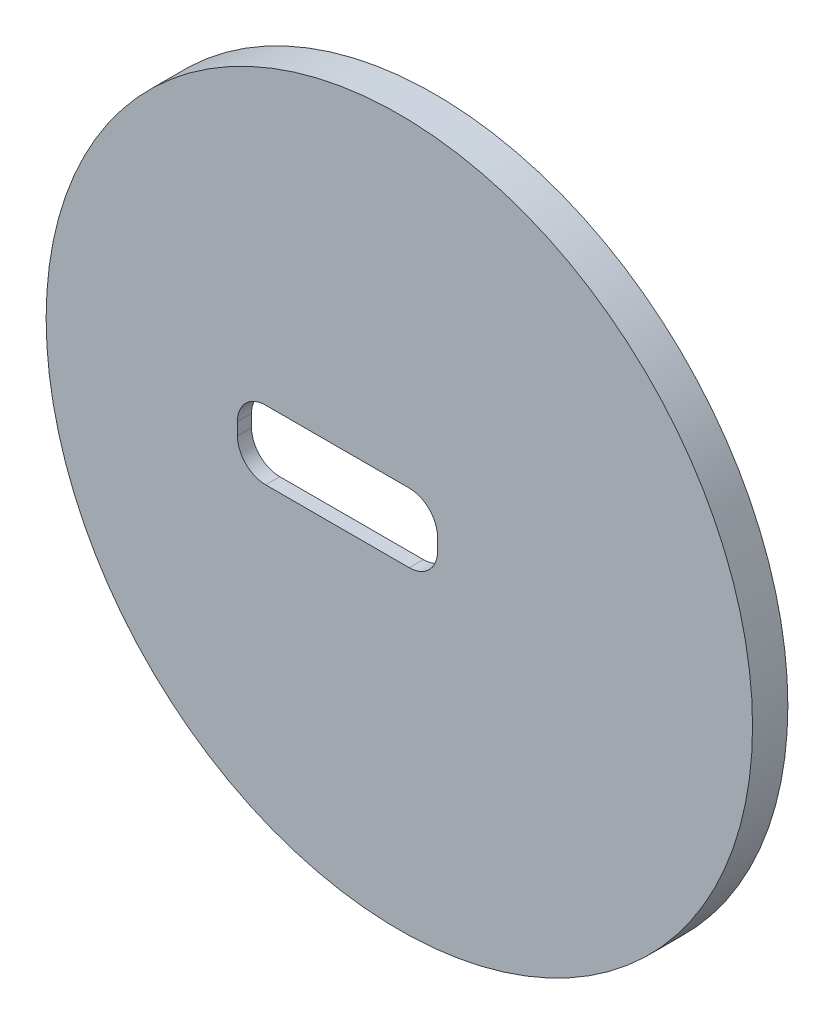
from build123d import *

# Parameters (mm, degrees)
SKETCH3_R           = 63.5
BOSS_EXTRUDE1_DEPTH = 6.35
SKETCH2_W           = 46.99
SKETCH2_H           = 26.67
CUT_EXTRUDE1_DEPTH  = 3.81
FILLET1_R           = 6.35
SKETCH6_W           = 35.970839212
SKETCH6_H           = 12.396108552
CUT_EXTRUDE2_DEPTH  = 6.35
FILLET2_R           = 5.08
SKETCH3_4_R         = 57.15
SKETCH3_4_W         = 60.426788384
SKETCH3_4_H         = 37.666233726
CUT_EXTRUDE4_DEPTH  = 3.81
FILLET3_R           = 5.08


with BuildPart() as part:
    # Sketch3 → Boss-Extrude1 (new body)
    with BuildSketch(Plane.XY):
        Circle(SKETCH3_R)
    extrude(amount=BOSS_EXTRUDE1_DEPTH)

    # Sketch2 → Cut-Extrude1 (cut)
    with BuildSketch(Plane.XY):
        with Locations((-11.125000102, 0)):
            Rectangle(SKETCH2_W, SKETCH2_H)
    extrude(amount=CUT_EXTRUDE1_DEPTH, mode=Mode.SUBTRACT)

    # Fillet1
    fillet1_edges = [part.edges().sort_by_distance(p)[0] for p in [
        (-34.620000102, 13.335, 1.905),
        (12.369999898, 13.335, 1.905),
        (-34.620000102, -13.335, 1.905),
        (12.369999898, -13.335, 1.905),
    ]]
    fillet(fillet1_edges, radius=FILLET1_R)

    # Sketch6 → Cut-Extrude2 (cut)
    with BuildSketch(Plane.XY):
        with Locations((-11.125000102, 0)):
            Rectangle(SKETCH6_W, SKETCH6_H)
    extrude(amount=CUT_EXTRUDE2_DEPTH, mode=Mode.SUBTRACT)

    # Fillet2
    fillet2_edges = [part.edges().sort_by_distance(p)[0] for p in [
        (-29.110419708, -6.198054276, 5.08),
        (-29.110419708, 6.198054276, 5.08),
        (6.860419504, 6.198054276, 5.08),
        (6.860419504, -6.198054276, 5.08),
    ]]
    fillet(fillet2_edges, radius=FILLET2_R)

    # Sketch3<4> → Cut-Extrude4 (cut)
    with BuildSketch(Plane.XY):
        Circle(SKETCH3_4_R)
        with Locations((-11.125000102, 0)):
            Rectangle(SKETCH3_4_W, SKETCH3_4_H, mode=Mode.SUBTRACT)
    extrude(amount=CUT_EXTRUDE4_DEPTH, mode=Mode.SUBTRACT)

    # Fillet3
    fillet3_edges = [part.edges().sort_by_distance(p)[0] for p in [
        (19.08839409, -18.833116863, 1.905),
        (19.08839409, 18.833116863, 1.905),
        (-41.338394294, -18.833116863, 1.905),
        (-41.338394294, 18.833116863, 1.905),
    ]]
    fillet(fillet3_edges, radius=FILLET3_R)


solid = part.part
